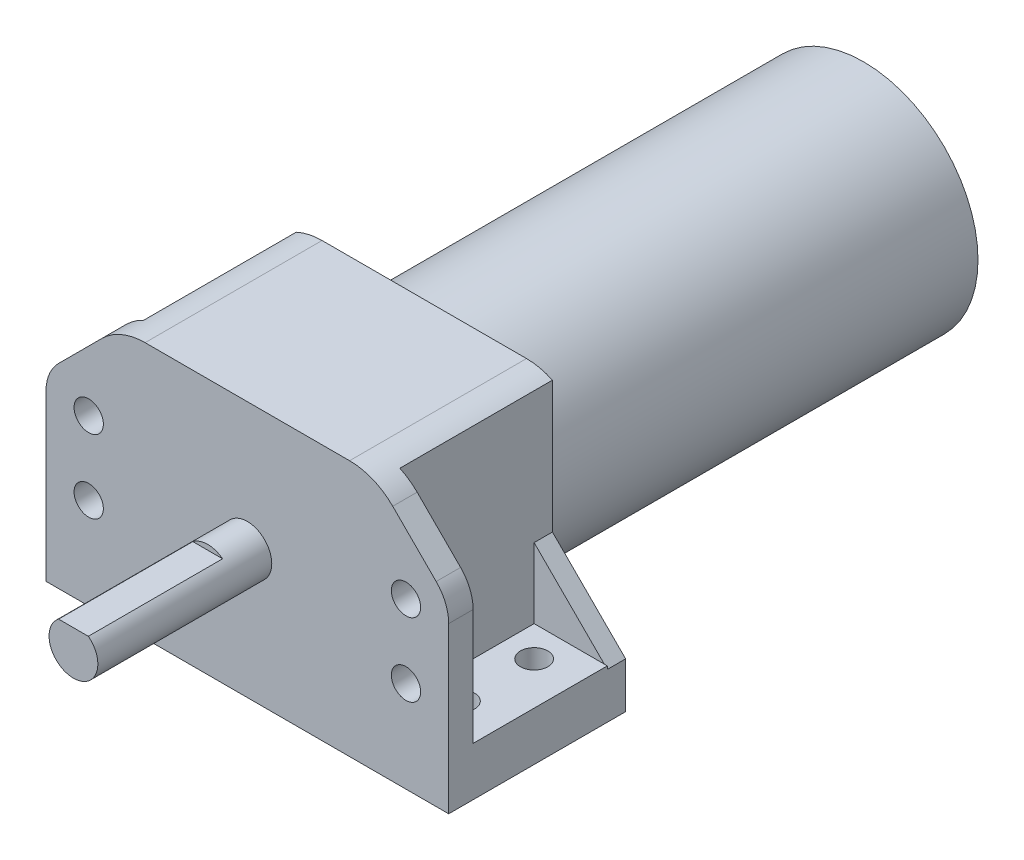
from build123d import *

# Parameters (mm, degrees)
CROQUIS2_R              = 18.75
SALIENTE_EXTRUIR1_DEPTH = 129.5
CORTAR_EXTRUIR1_START   = -28.5
CROQUIS3_R              = 18.75
CROQUIS3_R_2            = 4
CORTAR_EXTRUIR1_DEPTH   = 28.5
CROQUIS4_W              = 66
CROQUIS4_H              = 42
SALIENTE_EXTRUIR2_DEPTH = 29
CROQUIS5_R              = 2.4
CORTAR_EXTRUIR2_DEPTH   = 109.309741021
CROQUIS6_R              = 2.25
CORTAR_EXTRUIR3_DEPTH   = 141.083011104
CORTAR_EXTRUIR4_DEPTH   = 12
REDONDEO1_R             = 10
CORTAR_EXTRUIR5_START   = -22
CORTAR_EXTRUIR5_DEPTH   = 22
SALIENTE_EXTRUIR3_START = -3
CROQUIS9_R              = 2.4
SALIENTE_EXTRUIR3_DEPTH = 3
CORTAR_EXTRUIR6_DEPTH   = 3


with BuildPart() as part:
    # Croquis2 → Saliente-Extruir1 (new body)
    with BuildSketch(Plane.XY):
        Circle(CROQUIS2_R)
    extrude(amount=SALIENTE_EXTRUIR1_DEPTH)

    # Croquis3 → Cortar-Extruir1 (cut)
    with BuildSketch(Plane.XY.offset(129.5).offset(CORTAR_EXTRUIR1_START)):
        Circle(CROQUIS3_R)
        Circle(CROQUIS3_R_2, mode=Mode.SUBTRACT)
    extrude(amount=CORTAR_EXTRUIR1_DEPTH, mode=Mode.SUBTRACT)

    # Croquis4 → Saliente-Extruir2 (add)
    with BuildSketch(Plane.XY.offset(101)):
        Rectangle(CROQUIS4_W, CROQUIS4_H)
    extrude(amount=-SALIENTE_EXTRUIR2_DEPTH)

    # Croquis5 → Cortar-Extruir2 (cut, through all)
    with BuildSketch(Plane.XY.offset(101)):
        with Locations((-26, 6)):
            Circle(CROQUIS5_R)
        with Locations((-26, -6)):
            Circle(CROQUIS5_R)
        with Locations(Location((26, -6, 0), (0, 0, 180))):
            Circle(CROQUIS5_R)
        with Locations(Location((26, 6, 0), (0, 0, 180))):
            Circle(CROQUIS5_R)
        with BuildLine():
            Line((-33, 6), (-33, 21))
            Line((-33, 21), (-20.899494937, 21))
            Line((-20.899494937, 21), (-30.949747468, 10.949747468))
            ThreePointArc((-30.949747468, 10.949747468), (-32.467156728, 8.678784027), (-33, 6))
        make_face()
        with BuildLine():
            Line((33, 21), (20.899494937, 21))
            Line((20.899494937, 21), (30.949747468, 10.949747468))
            ThreePointArc((30.949747468, 10.949747468), (32.467156728, 8.678784027), (33, 6))
            Line((33, 6), (33, 21))
        make_face()
    extrude(amount=-CORTAR_EXTRUIR2_DEPTH, mode=Mode.SUBTRACT)

    # Croquis6 → Cortar-Extruir3 (cut, through all)
    with BuildSketch(Plane.XZ.offset(21)):
        with Locations((-26, 92)):
            Circle(CROQUIS6_R)
        with Locations((-26, 80)):
            Circle(CROQUIS6_R)
        with Locations((26, 80)):
            Circle(CROQUIS6_R)
        with Locations((26, 92)):
            Circle(CROQUIS6_R)
    extrude(amount=-CORTAR_EXTRUIR3_DEPTH, mode=Mode.SUBTRACT)

    # Croquis7 → Cortar-Extruir4 (cut)
    with BuildSketch(Plane(origin=(33, 0, 0), x_dir=(0, 0, -1), z_dir=(1, 0, 0))):
        Polygon((-97, 21), (-97, -13), (-75, -13), (-75, -1.5), (-72, -1.5), (-72, 21), align=None)
    cortar_extruir4 = extrude(amount=-CORTAR_EXTRUIR4_DEPTH, mode=Mode.SUBTRACT)

    # Simetría1: Cortar-Extruir4 across plane
    add(cortar_extruir4.mirror(Plane(origin=(0, 0, 0), x_dir=(0, 0, 1), z_dir=(1, 0, 0))), mode=Mode.SUBTRACT)

    # Redondeo1
    redondeo1_edges = [part.edges().sort_by_distance(p)[0] for p in [
        (-20.899494937, 21, 86.5),
        (20.899494937, 21, 86.5),
    ]]
    fillet(redondeo1_edges, radius=REDONDEO1_R)

    # Croquis8 → Cortar-Extruir5 (cut)
    with BuildSketch(Plane.XY.offset(129.5).offset(CORTAR_EXTRUIR5_START)):
        with BuildLine():
            Line((-2.439487651, 3.17), (2.439487651, 3.17))
            ThreePointArc((2.439487651, 3.17), (0, 4), (-2.439487651, 3.17))
        make_face()
    extrude(amount=CORTAR_EXTRUIR5_DEPTH, mode=Mode.SUBTRACT)

    # Croquis9 → Saliente-Extruir3 (add)
    with BuildSketch(Plane(origin=(0, 0, 72), x_dir=(-1, 0, 0), z_dir=(0, 0, -1)).offset(SALIENTE_EXTRUIR3_START)):
        with Locations(Location((26, -6, 0), (0, 0, 180))):
            Circle(CROQUIS9_R)
        with Locations(Location((-26, -6, 0), (0, 0, 180))):
            Circle(CROQUIS9_R)
    extrude(amount=SALIENTE_EXTRUIR3_DEPTH)

    # Croquis10 → Cortar-Extruir6 (cut)
    with BuildSketch(Plane(origin=(0, 0, 72), x_dir=(-1, 0, 0), z_dir=(0, 0, -1))):
        Polygon((-21, -1.5), (-33, -13.5), (-33, -1.5), align=None)
        Polygon((33, -1.5), (21, -1.5), (33, -13.5), align=None)
    extrude(amount=-CORTAR_EXTRUIR6_DEPTH, mode=Mode.SUBTRACT)


solid = part.part
